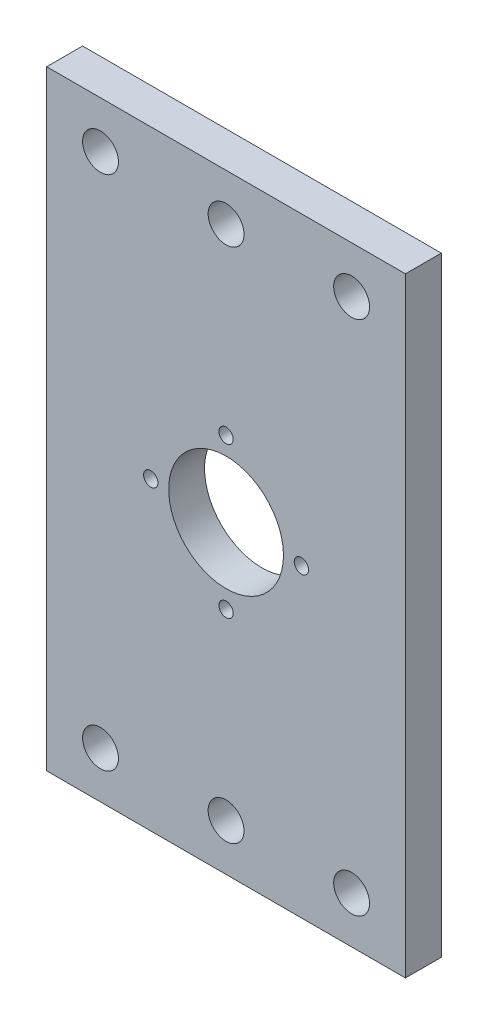
from build123d import *

# Parameters (mm, degrees)
EXTRUDE_1_DEPTH          = 10
SKETCH_2_R               = 16
CUT_EXTRUDE_1_DEPTH      = 10
SKETCH_3_R               = 5
CUT_EXTRUDE_2_DEPTH      = 10
SKETCH_6_R               = 2
CUT_EXTRUDE_4_DEPTH      = 10
PATTERN_CIRCULAR_1_COUNT = 4


with BuildPart() as part:
    # 草图1 → 凸台-拉伸1 (new body)
    with BuildSketch(Plane.XY):
        Polygon((50, -85), (-50, -85), (-50, -40), (-50, 85), (50, 85), (50, 0), align=None)
    extrude(amount=EXTRUDE_1_DEPTH)

    # 草图2 → 切除-拉伸1 (cut)
    with BuildSketch(Plane.XY.offset(10)):
        Circle(SKETCH_2_R)
    extrude(amount=-CUT_EXTRUDE_1_DEPTH, mode=Mode.SUBTRACT)

    # 草图3 → 切除-拉伸2 (cut)
    with BuildSketch(Plane.XY.offset(10)):
        with Locations((0, -72)):
            Circle(SKETCH_3_R)
        with Locations((35, -72)):
            Circle(SKETCH_3_R)
        with Locations((-35, -72)):
            Circle(SKETCH_3_R)
    cut_extrude_2 = extrude(amount=-CUT_EXTRUDE_2_DEPTH, mode=Mode.SUBTRACT)

    # 草图6 → 切除-拉伸4 (cut)
    with BuildSketch(Plane.XY.offset(10)):
        with Locations((0, 21)):
            Circle(SKETCH_6_R)
    cut_extrude_4 = extrude(amount=-CUT_EXTRUDE_4_DEPTH, mode=Mode.SUBTRACT)

    # 阵列(圆周)1: 切除-拉伸4 ×4 about axis
    pattern_circular_1_axis = Axis((0, 0, 0), (0, 0, 1))
    for i in range(1, PATTERN_CIRCULAR_1_COUNT):
        add(cut_extrude_4.rotate(pattern_circular_1_axis, i * 360 / PATTERN_CIRCULAR_1_COUNT), mode=Mode.SUBTRACT)

    # 镜向1: 切除-拉伸2 across plane
    add(cut_extrude_2.mirror(Plane.ZX), mode=Mode.SUBTRACT)


solid = part.part
